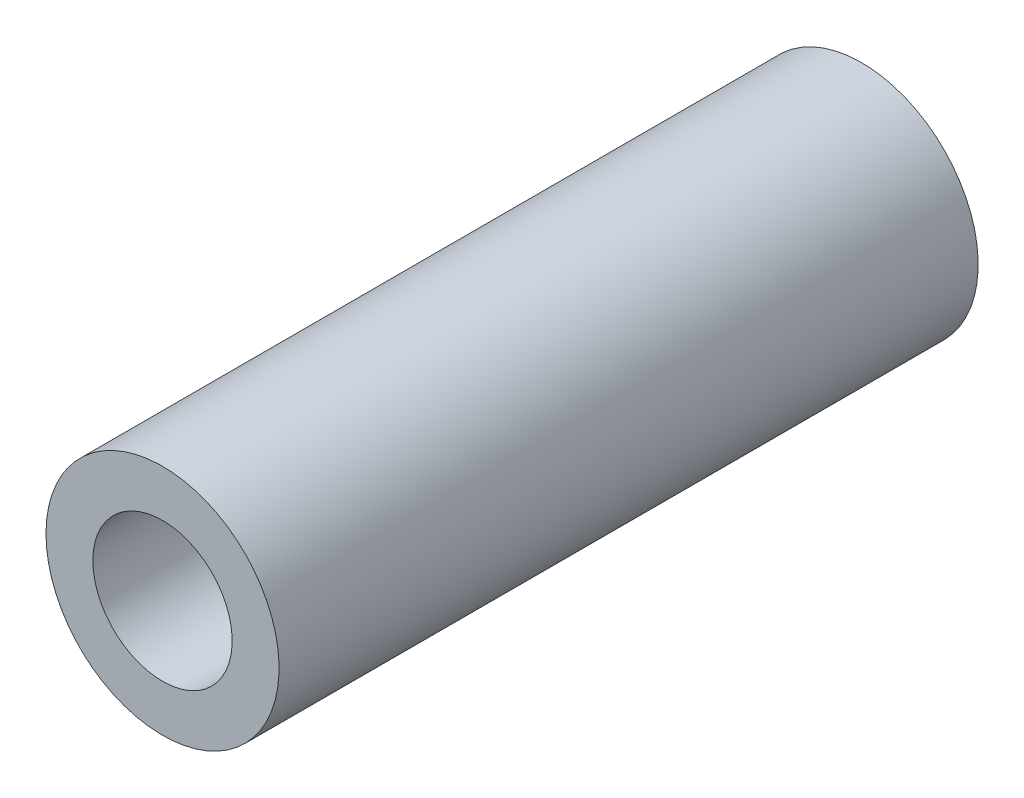
from build123d import *

# Parameters (mm, degrees)
SKETCH1_R           = 3.175
SKETCH1_R_2         = 1.89865
BOSS_EXTRUDE1_DEPTH = 19.05


with BuildPart() as part:
    # Sketch1 → Boss-Extrude1 (new body)
    with BuildSketch(Plane.XY):
        with Locations(Location((0, 0, 0), (0, 0, 180))):
            Circle(SKETCH1_R)
        with Locations(Location((0, 0, 0), (0, 0, 180))):
            Circle(SKETCH1_R_2, mode=Mode.SUBTRACT)
    extrude(amount=BOSS_EXTRUDE1_DEPTH)


solid = part.part
